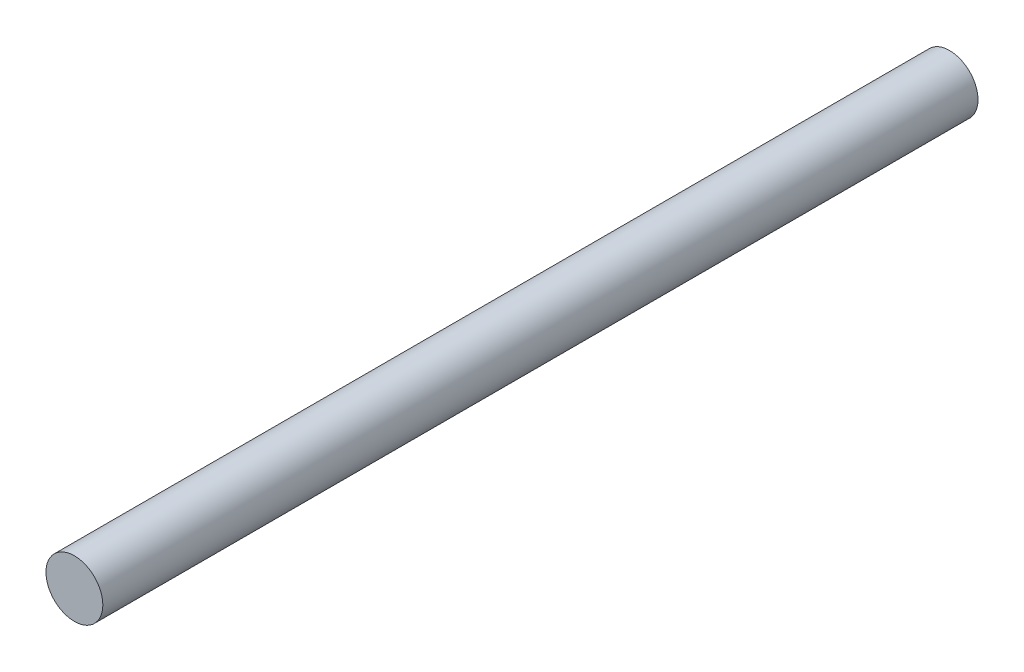
from build123d import *

# Parameters (mm, degrees)
SKETCH1_R           = 13
BOSS_EXTRUDE1_DEPTH = 400


with BuildPart() as part:
    # Sketch1 → Boss-Extrude1 (new body)
    with BuildSketch(Plane.XY):
        Circle(SKETCH1_R)
    extrude(amount=BOSS_EXTRUDE1_DEPTH)


solid = part.part
